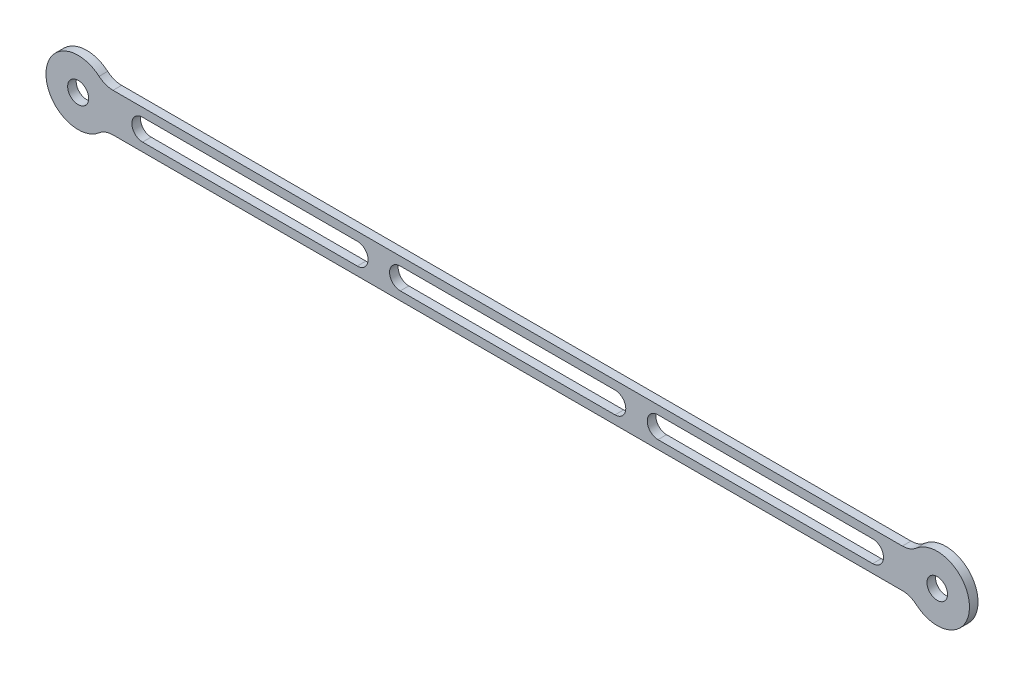
from build123d import *

# Parameters (mm, degrees)
SKETCH1_R           = 7.5
SKETCH1_R_2         = 2.45
SKETCH1_R_3         = 2.4
SKETCH1_W           = 188.02
SKETCH1_H           = 9
BOSS_EXTRUDE1_DEPTH = 2
CUT_EXTRUDE1_DEPTH  = 208.665115992
FILLET1_R           = 5


with BuildPart() as part:
    # Sketch1 → Boss-Extrude1 (new body)
    # profile 1 of 3: a face of its own
    with BuildSketch(Plane.XY):
        Circle(SKETCH1_R)
        Circle(SKETCH1_R_2, mode=Mode.SUBTRACT)
    # profile 2 of 3: a face of its own
    with BuildSketch(Plane.XY):
        with Locations((200.02, 0)):
            Circle(SKETCH1_R)
        with Locations((200.02, 0)):
            Circle(SKETCH1_R_3, mode=Mode.SUBTRACT)
    # profile 3 of 3: a face of its own
    with BuildSketch(Plane.XY):
        with Locations((100.01, 0)):
            Rectangle(SKETCH1_W, SKETCH1_H)
    extrude(amount=BOSS_EXTRUDE1_DEPTH)

    # Sketch2 → Cut-Extrude1 (cut, through all)
    with BuildSketch(Plane.XY.offset(2)):
        with BuildLine():
            Line((75, 2.5), (125, 2.5))
            ThreePointArc((125, 2.5), (127.5, 0), (125, -2.5))
            Line((125, -2.5), (75, -2.5))
            ThreePointArc((75, -2.5), (72.5, 0), (75, 2.5))
        make_face()
        with BuildLine():
            Line((135, 2.5), (185, 2.5))
            ThreePointArc((185, 2.5), (187.5, 0), (185, -2.5))
            Line((185, -2.5), (135, -2.5))
            ThreePointArc((135, -2.5), (132.5, 0), (135, 2.5))
        make_face()
        with BuildLine():
            Line((15, 2.5), (65, 2.5))
            ThreePointArc((65, 2.5), (67.5, 0), (65, -2.5))
            Line((65, -2.5), (15, -2.5))
            ThreePointArc((15, -2.5), (12.5, 0), (15, 2.5))
        make_face()
    extrude(amount=-CUT_EXTRUDE1_DEPTH, mode=Mode.SUBTRACT)

    # Fillet1
    fillet1_edges = [part.edges().sort_by_distance(p)[0] for p in [
        (6, -4.5, 1),
        (6, 4.5, 1),
        (194.02, 4.5, 1),
        (194.02, -4.5, 1),
    ]]
    fillet(fillet1_edges, radius=FILLET1_R)


solid = part.part
